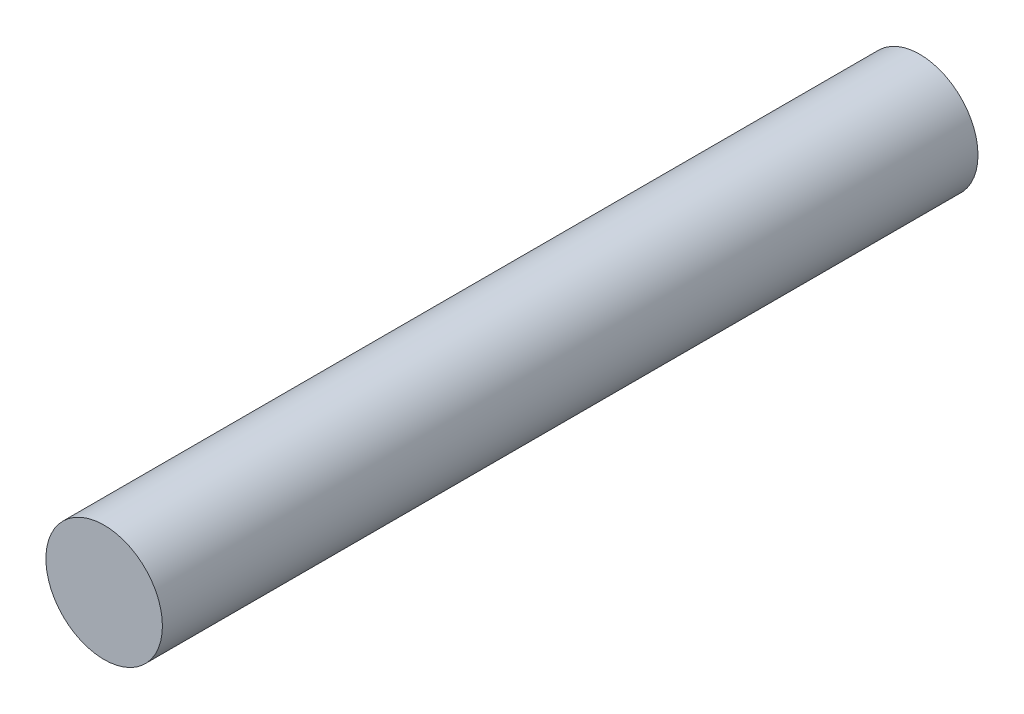
from build123d import *

# Parameters (mm, degrees)
SKETCH1_R           = 6.35
BOSS_EXTRUDE1_DEPTH = 88.9


with BuildPart() as part:
    # Sketch1 → Boss-Extrude1 (new body)
    with BuildSketch(Plane.XY):
        with Locations((-736.6, -12.7)):
            Circle(SKETCH1_R)
    extrude(amount=BOSS_EXTRUDE1_DEPTH)


solid = part.part
